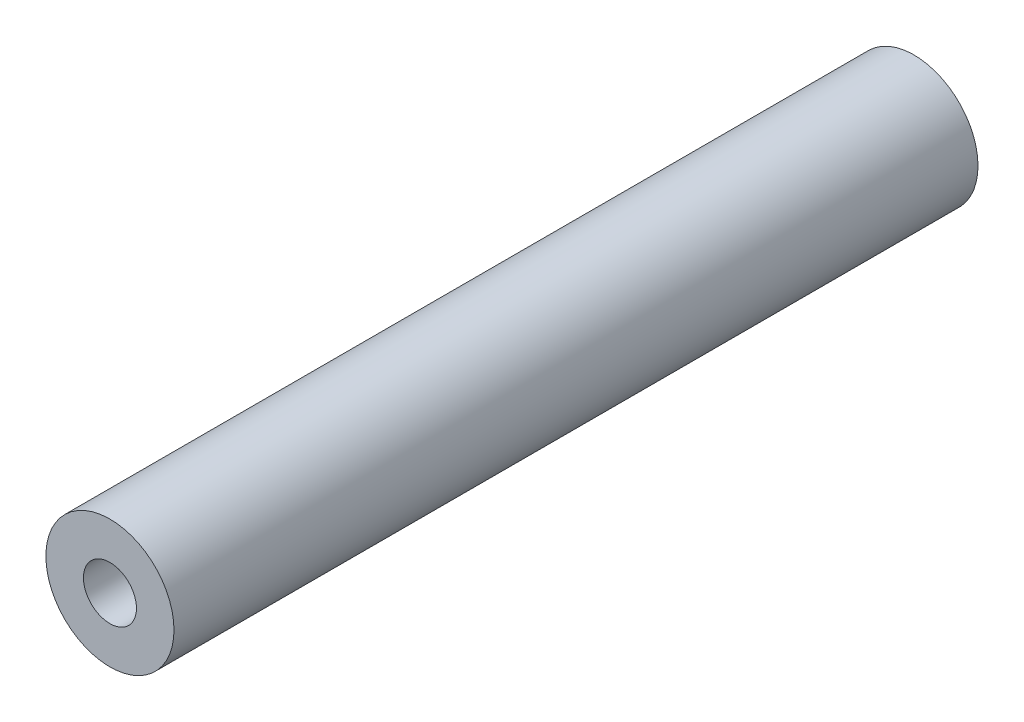
from build123d import *

# Parameters (mm, degrees)
SKETCH2_R           = 7.366
SKETCH2_R_2         = 3.048
BOSS_EXTRUDE1_DEPTH = 92.456


with BuildPart() as part:
    # Sketch2 → Boss-Extrude1 (new body)
    with BuildSketch(Plane.XY):
        Circle(SKETCH2_R)
        Circle(SKETCH2_R_2, mode=Mode.SUBTRACT)
    extrude(amount=BOSS_EXTRUDE1_DEPTH)


solid = part.part
